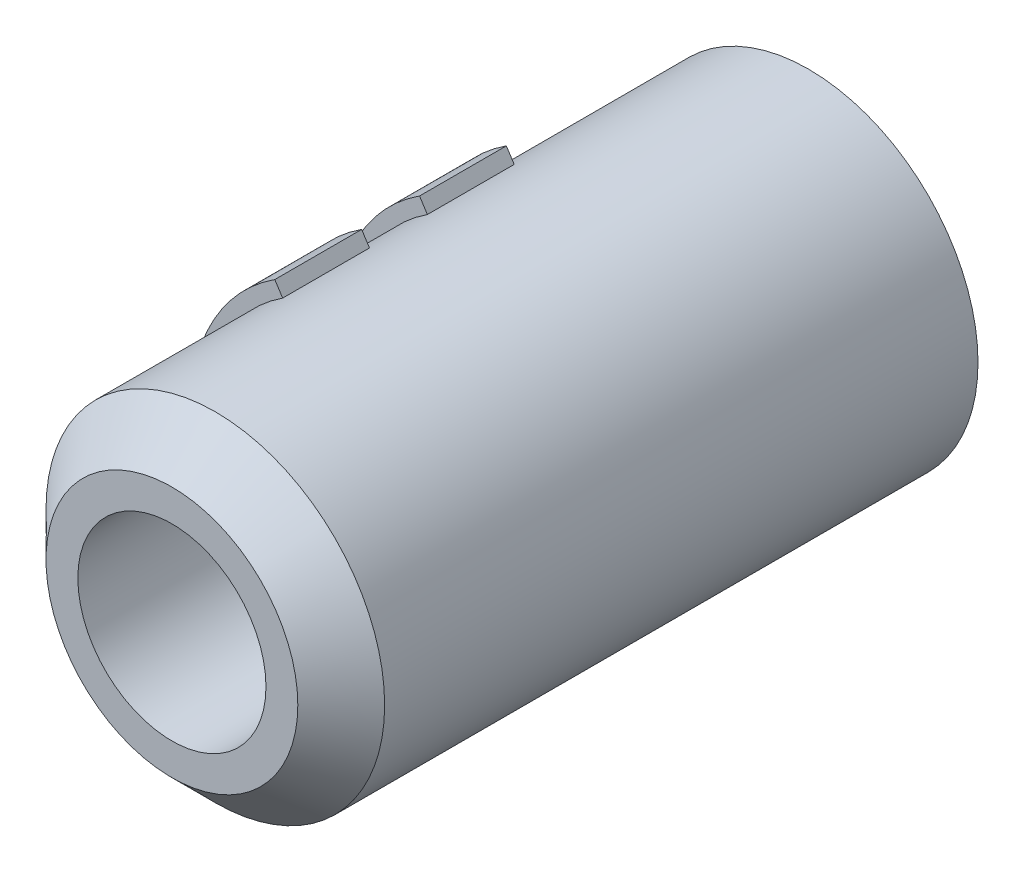
from build123d import *

# Parameters (mm, degrees)
SKETCH_1_R      = 5.85
SKETCH_1_R_2    = 3.25
EXTRUDE_1_DEPTH = 22
CHAMFER_1_SIZE  = 1.5
EXTRUDE_START   = -10
EXTRUDE_2_DEPTH = 3
EXTRUDE_START_2 = 5
EXTRUDE_3_DEPTH = 3


with BuildPart() as part:
    # 草图1 → 凸台-拉伸1 (new body)
    with BuildSketch(Plane.XY):
        Circle(SKETCH_1_R)
        Circle(SKETCH_1_R_2, mode=Mode.SUBTRACT)
    extrude(amount=EXTRUDE_1_DEPTH)

    # 倒角1
    chamfer_1_edges = [part.edges().sort_by_distance(p)[0] for p in [
        (-5.85, 0, 22),
    ]]
    chamfer(chamfer_1_edges, length=CHAMFER_1_SIZE)

    # 草图2 → 凸台-拉伸2 (add)
    with BuildSketch(Plane.XY.offset(22).offset(EXTRUDE_START)):
        with BuildLine():
            Line((-3.173831975, 4.914192771), (-3.445099666, 5.334209247))
            ThreePointArc((-3.445099666, 5.334209247), (-6.246549311, -1.141543565), (-1.335802196, -6.207908866))
            Line((-1.335802196, -6.207908866), (-1.23062092, -5.719097145))
            ThreePointArc((-1.23062092, -5.719097145), (-5.754695034, -1.051658245), (-3.173831975, 4.914192771))
        make_face()
    extrude(amount=EXTRUDE_2_DEPTH)

    # 草图3 → 凸台-拉伸3 (add)
    with BuildSketch(Plane(origin=(0, 0, 12), x_dir=(-1, 0, 0), z_dir=(0, 0, -1)).offset(EXTRUDE_START_2)):
        with BuildLine():
            Line((1.23062092, -5.719097145), (1.335802196, -6.207908866))
            ThreePointArc((1.335802196, -6.207908866), (6.246549311, -1.141543565), (3.445099666, 5.334209247))
            Line((3.445099666, 5.334209247), (3.173831975, 4.914192771))
            ThreePointArc((3.173831975, 4.914192771), (5.754695034, -1.051658245), (1.23062092, -5.719097145))
        make_face()
    extrude(amount=-EXTRUDE_3_DEPTH)


solid = part.part
